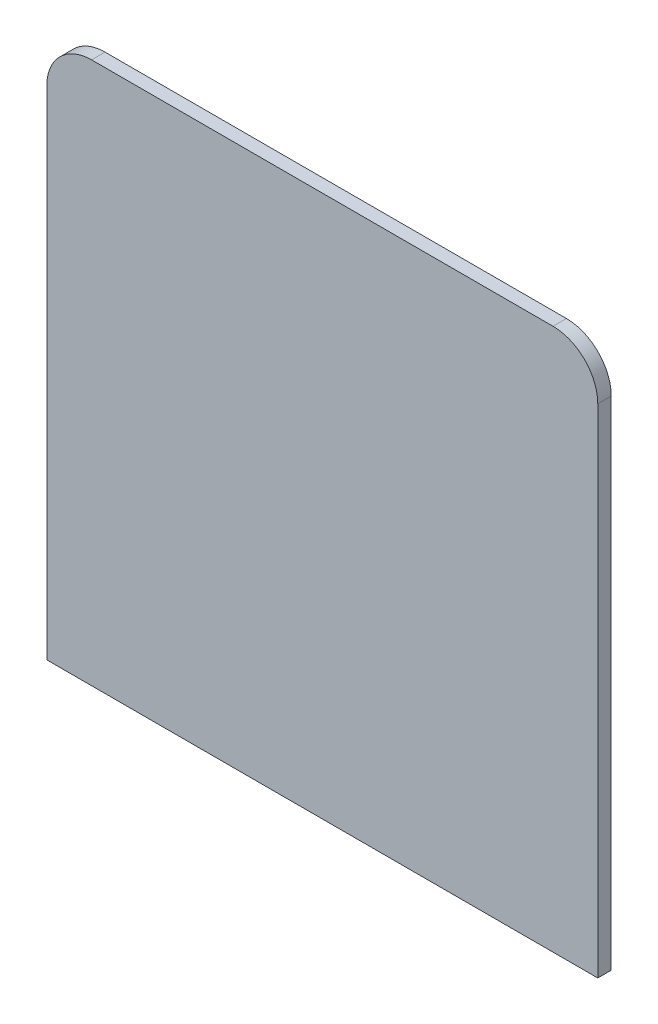
from build123d import *

# Parameters (mm, degrees)
SKETCH1_W           = 123
SKETCH1_H           = 121
BOSS_EXTRUDE1_DEPTH = 3
FILLET1_R           = 10


with BuildPart() as part:
    # Sketch1 → Boss-Extrude1 (new body)
    with BuildSketch(Plane.XY):
        Rectangle(SKETCH1_W, SKETCH1_H)
    extrude(amount=BOSS_EXTRUDE1_DEPTH)

    # Fillet1
    fillet1_edges = [part.edges().sort_by_distance(p)[0] for p in [
        (-61.5, 60.5, 1.5),
        (61.5, 60.5, 1.5),
    ]]
    fillet(fillet1_edges, radius=FILLET1_R)


solid = part.part
